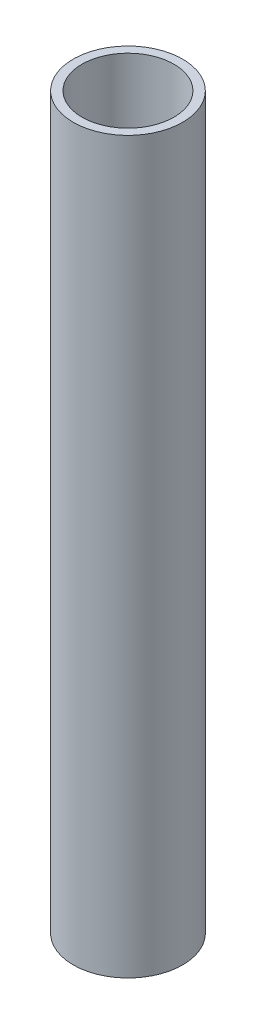
from build123d import *

# Parameters (mm, degrees)
SKETCH1_R           = 9.525
BOSS_EXTRUDE1_DEPTH = 127
SKETCH2_R           = 8.001
CUT_EXTRUDE1_DEPTH  = 128.712377043


with BuildPart() as part:
    # Sketch1 → Boss-Extrude1 (new body)
    with BuildSketch(Plane(origin=(0, 0, 0), x_dir=(1, 0, 0), z_dir=(0, 1, 0))):
        with Locations(Location((0, 0, 0), (0, 0, 270))):
            Circle(SKETCH1_R)
    extrude(amount=BOSS_EXTRUDE1_DEPTH)

    # Sketch2 → Cut-Extrude1 (cut, through all)
    with BuildSketch(Plane(origin=(0, 127, 0), x_dir=(1, 0, 0), z_dir=(0, 1, 0))):
        with Locations(Location((0, 0, 0), (0, 0, 270))):
            Circle(SKETCH2_R)
    extrude(amount=-CUT_EXTRUDE1_DEPTH, mode=Mode.SUBTRACT)


solid = part.part
